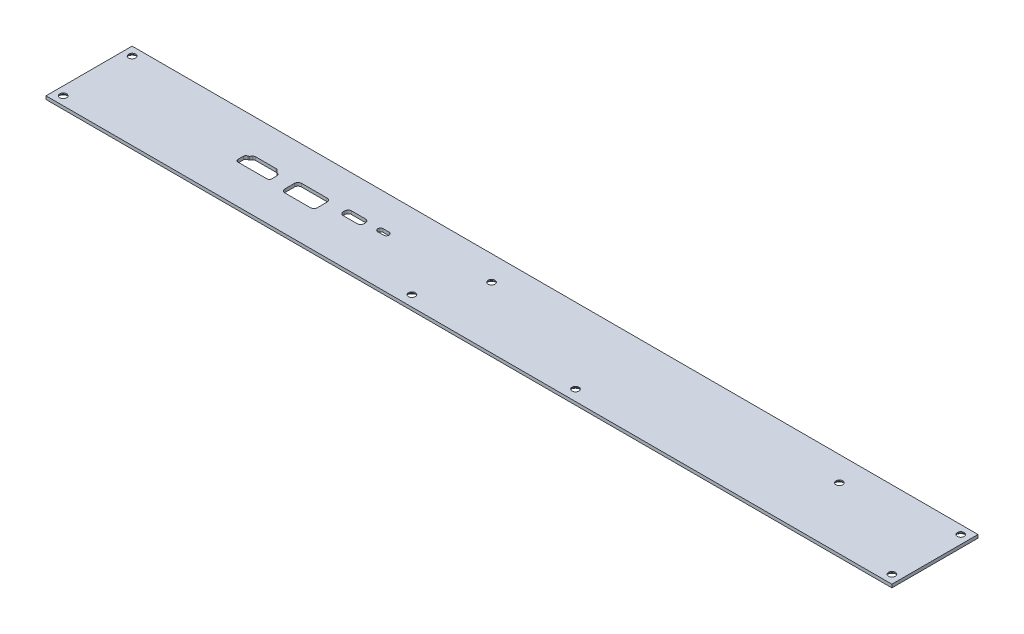
from build123d import *

# Parameters (mm, degrees)
SKIZZE1_W                       = 393
SKIZZE1_H                       = 40
AUFSATZ_LINEAR_AUSTRAGEN1_DEPTH = 1.5
SKIZZE2_R                       = 1.6
SCHNITT_LINEAR_AUSTRAGEN1_DEPTH = 198.520884972
FASE1_SIZE                      = 1
SCHNITT_LINEAR_AUSTRAGEN2_DEPTH = 198.520884972


with BuildPart() as part:
    # Skizze1 → Aufsatz-Linear austragen1 (new body)
    with BuildSketch(Plane(origin=(0, 0, 0), x_dir=(1, 0, 0), z_dir=(0, 1, 0))):
        Rectangle(SKIZZE1_W, SKIZZE1_H)
    extrude(amount=AUFSATZ_LINEAR_AUSTRAGEN1_DEPTH)

    # Skizze2 → Schnitt-Linear austragen1 (cut, through all)
    with BuildSketch(Plane(origin=(0, 1.5, 0), x_dir=(1, 0, 0), z_dir=(0, 1, 0))):
        with Locations(Location((-192.5, 16, 0), (0, 0, 270))):
            Circle(SKIZZE2_R)
        with Locations(Location((-192.5, -16, 0), (0, 0, 270))):
            Circle(SKIZZE2_R)
        with Locations(Location((192.5, -16, 0), (0, 0, 270))):
            Circle(SKIZZE2_R)
        with Locations(Location((192.5, 16, 0), (0, 0, 270))):
            Circle(SKIZZE2_R)
        with Locations(Location((44.5, -15, 0), (0, 0, 270))):
            Circle(SKIZZE2_R)
        with BuildLine():
            ThreePointArc((-16.400011, 8.5), (-16.86864015, 9.63137085), (-18.000011, 10.1))
            Line((-18.000011, 10.1), (-18.000011, 6.9))
            ThreePointArc((-18.000011, 6.9), (-16.86864015, 7.36862915), (-16.400011, 8.5))
        make_face()
        with BuildLine():
            Line((-18.000011, 6.9), (-18.000011, 10.1))
            ThreePointArc((-18.000011, 10.1), (-19.600011, 8.5), (-18.000011, 6.9))
        make_face()
        with BuildLine():
            ThreePointArc((145.099964038, 8.589999773), (144.631340773, 9.721364737), (143.499980683, 10.189999773))
            Line((143.499980683, 10.189999773), (143.499947392, 6.989999773))
            ThreePointArc((143.499947392, 6.989999773), (144.631329002, 7.458623038), (145.099964038, 8.589999773))
        make_face()
        with BuildLine():
            Line((143.499947392, 6.989999773), (143.499980683, 10.189999773))
            ThreePointArc((143.499980683, 10.189999773), (141.899964038, 8.590016418), (143.499947392, 6.989999773))
        make_face()
        with Locations(Location((-31.5, -15, 0), (0, 0, 270))):
            Circle(SKIZZE2_R)
    extrude(amount=-SCHNITT_LINEAR_AUSTRAGEN1_DEPTH, mode=Mode.SUBTRACT)

    # Fase1
    fase1_edges = [part.edges().sort_by_distance(p)[0] for p in [
        (44.5, 0, 13.4),
        (192.5, 0, -17.6),
        (192.5, 0, 14.4),
        (-192.5, 0, 14.4),
        (-18.000011, 0, -10.1),
        (143.499947392, 0, -6.989999773),
        (-31.5, 0, 13.4),
        (-192.5, 0, -17.6),
    ]]
    chamfer(fase1_edges, length=FASE1_SIZE)

    # Skizze3 → Schnitt-Linear austragen2 (cut, through all)
    with BuildSketch(Plane.XZ):
        with BuildLine():
            Line((-64.700005979, -2.35700022), (-62.000005979, -2.35700022))
            ThreePointArc((-62.000005979, -2.35700022), (-60.750005979, -3.60700022), (-62.000005979, -4.85700022))
            Line((-62.000005979, -4.85700022), (-64.700005979, -4.85700022))
            ThreePointArc((-64.700005979, -4.85700022), (-65.950005979, -3.60700022), (-64.700005979, -2.35700022))
        make_face()
        with BuildLine():
            Line((-111.800007059, 2.092999135), (-125.200007059, 2.093000306))
            ThreePointArc((-125.200007059, 2.093000306), (-126.013179849, 1.756173213), (-126.350007159, 0.943000513))
            Line((-126.350007159, 0.943000513), (-126.350007376, -1.535427197))
            ThreePointArc((-126.350007376, -1.535427197), (-126.125055687, -2.21864441), (-125.538206197, -2.634573128))
            Line((-125.538206197, -2.634573128), (-125.004483233, -2.79879563))
            Line((-125.004483233, -2.79879563), (-124.152708289, -3.766721872))
            ThreePointArc((-124.152708289, -3.766721872), (-123.763106884, -4.054897814), (-123.289387767, -4.156999861))
            Line((-123.289387767, -4.156999861), (-113.710627438, -4.157000698))
            ThreePointArc((-113.710627438, -4.157000698), (-113.236908304, -4.054898732), (-112.847306849, -3.766722856))
            Line((-112.847306849, -3.766722856), (-111.995531741, -2.798796767))
            Line((-111.995531741, -2.798796767), (-111.461808748, -2.634574359))
            ThreePointArc((-111.461808748, -2.634574359), (-110.874959185, -2.218645743), (-110.650007376, -1.535428569))
            Line((-110.650007376, -1.535428569), (-110.650007159, 0.942999034))
            ThreePointArc((-110.650007159, 0.942999034), (-110.98683429, 1.756171862), (-111.800007059, 2.092999135))
        make_face()
        with BuildLine():
            Line((-101.915250235, 3.595995958), (-90.084765307, 3.595995958))
            ThreePointArc((-90.084765307, 3.595995958), (-88.918039118, 3.112722147), (-88.434765307, 1.945995958))
            Line((-88.434765307, 1.945995958), (-88.434765307, -2.510004042))
            ThreePointArc((-88.434765307, -2.510004042), (-88.918039118, -3.676730231), (-90.084765307, -4.160004042))
            Line((-90.084765307, -4.160004042), (-101.915250235, -4.160004042))
            ThreePointArc((-101.915250235, -4.160004042), (-103.081976424, -3.676730231), (-103.565250235, -2.510004042))
            Line((-103.565250235, -2.510004042), (-103.565250235, 1.945995958))
            ThreePointArc((-103.565250235, 1.945995958), (-103.081976424, 3.112722147), (-101.915250235, 3.595995958))
        make_face()
        with BuildLine():
            Line((-79.224953939, -0.821999997), (-72.774953939, -0.821999997))
            ThreePointArc((-72.774953939, -0.821999997), (-71.643582904, -1.290629498), (-71.174953542, -2.42200059))
            Line((-71.174953542, -2.42200059), (-71.174954106, -3.082000561))
            ThreePointArc((-71.174954106, -3.082000561), (-71.643583256, -4.213371411), (-72.774954106, -4.682000561))
            Line((-72.774954106, -4.682000561), (-79.224954215, -4.681999997))
            ThreePointArc((-79.224954215, -4.681999997), (-80.356325086, -4.21337078), (-80.824954106, -3.081999827))
            Line((-80.824954106, -3.081999827), (-80.824954106, -2.422000164))
            ThreePointArc((-80.824954106, -2.422000164), (-80.356324907, -1.290629196), (-79.224953939, -0.821999997))
        make_face()
    extrude(amount=-SCHNITT_LINEAR_AUSTRAGEN2_DEPTH, mode=Mode.SUBTRACT)


solid = part.part
